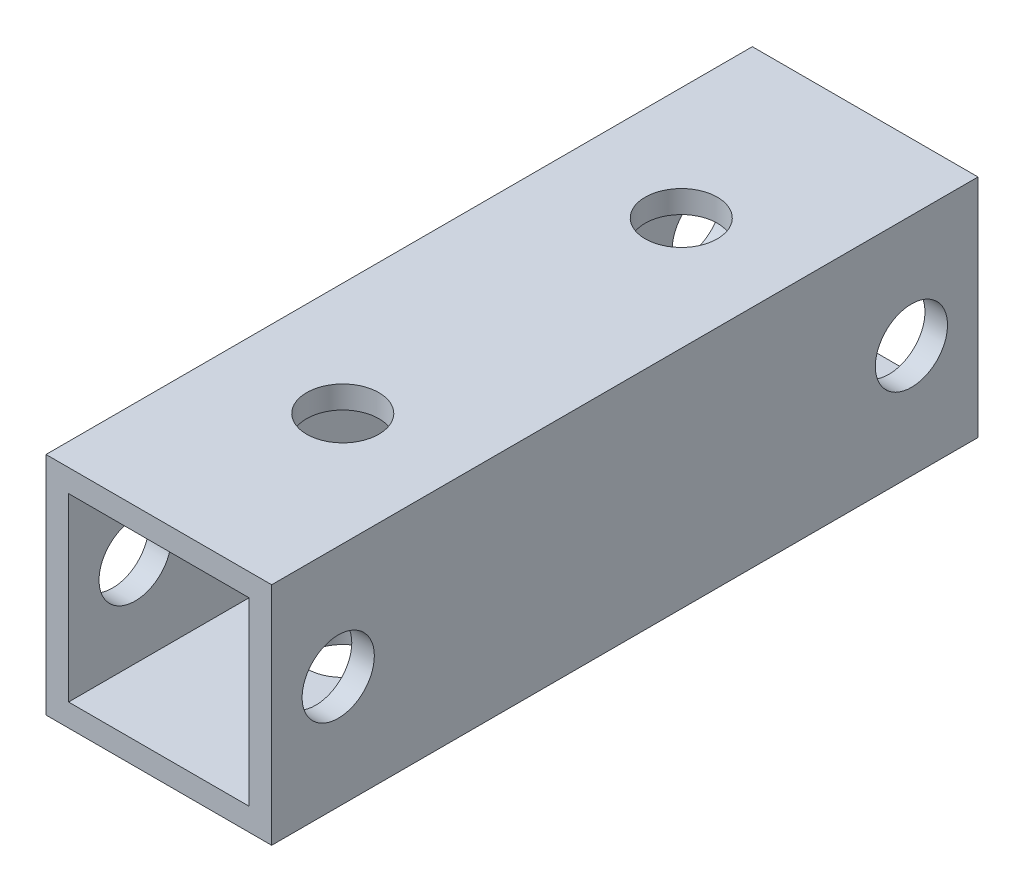
from build123d import *

# Parameters (mm, degrees)
SKETCH_2_W          = 10
SKETCH_2_H          = 10
SKETCH_2_W_2        = 8
SKETCH_2_H_2        = 8
EXTRUDE_1_DEPTH     = 31.3
CUT_EXTRUDE_1_REACH = 36.347
SKETCH_3_R          = 1.6
CUT_EXTRUDE_2_REACH = 36.347
SKETCH_4_R          = 1.6


with BuildPart() as part:
    # ｽｹｯﾁ2 → 押し出し-薄板1 (new body)
    with BuildSketch(Plane.XY):
        with Locations((5, 5)):
            Rectangle(SKETCH_2_W, SKETCH_2_H)
        with Locations((5, 5)):
            Rectangle(SKETCH_2_W_2, SKETCH_2_H_2, mode=Mode.SUBTRACT)
    extrude(amount=EXTRUDE_1_DEPTH)

    # ｶｯﾄ - 押し出し1: up to this face of the body (flat: up to its plane)
    cut_extrude_1_end = Plane(part.part.faces().sort_by_distance((5, 0, 15.65))[0])
    # ｽｹｯﾁ3 → ｶｯﾄ - 押し出し1 (cut, up to the picked face)
    with BuildSketch(Plane(origin=(0, 10, 0), x_dir=(1, 0, 0), z_dir=(0, 1, 0)), mode=Mode.PRIVATE) as cut_extrude_1_sk1:
        with Locations(Location((5, -23.15, 0), (0, 0, 270))):
            Circle(SKETCH_3_R)
    cut_extrude_1_tool1 = split(extrude(cut_extrude_1_sk1.sketch, amount=-CUT_EXTRUDE_1_REACH, mode=Mode.PRIVATE), bisect_by=cut_extrude_1_end, keep=Keep.BOTH, mode=Mode.PRIVATE)
    # ｽｹｯﾁ3 → ｶｯﾄ - 押し出し1 (cut, up to the picked face)
    with BuildSketch(Plane(origin=(0, 10, 0), x_dir=(1, 0, 0), z_dir=(0, 1, 0)), mode=Mode.PRIVATE) as cut_extrude_1_sk2:
        with Locations(Location((5, -8.15, 0), (0, 0, 270))):
            Circle(SKETCH_3_R)
    cut_extrude_1_tool2 = split(extrude(cut_extrude_1_sk2.sketch, amount=-CUT_EXTRUDE_1_REACH, mode=Mode.PRIVATE), bisect_by=cut_extrude_1_end, keep=Keep.BOTH, mode=Mode.PRIVATE)
    add(cut_extrude_1_tool1.solids().sort_by(Axis((5, 10, 23.15), (0, -1, 0)))[0], mode=Mode.SUBTRACT)
    add(cut_extrude_1_tool2.solids().sort_by(Axis((5, 10, 8.15), (0, -1, 0)))[0], mode=Mode.SUBTRACT)

    # ｶｯﾄ - 押し出し2: up to this face of the body (flat: up to its plane)
    cut_extrude_2_end = Plane(part.part.faces().sort_by_distance((0, 5, 15.65))[0])
    # ｽｹｯﾁ4 → ｶｯﾄ - 押し出し2 (cut, up to the picked face)
    with BuildSketch(Plane(origin=(10, 0, 0), x_dir=(0, 0, -1), z_dir=(1, 0, 0)), mode=Mode.PRIVATE) as cut_extrude_2_sk1:
        with Locations((-28.35, 5)):
            Circle(SKETCH_4_R)
    cut_extrude_2_tool1 = split(extrude(cut_extrude_2_sk1.sketch, amount=-CUT_EXTRUDE_2_REACH, mode=Mode.PRIVATE), bisect_by=cut_extrude_2_end, keep=Keep.BOTH, mode=Mode.PRIVATE)
    # ｽｹｯﾁ4 → ｶｯﾄ - 押し出し2 (cut, up to the picked face)
    with BuildSketch(Plane(origin=(10, 0, 0), x_dir=(0, 0, -1), z_dir=(1, 0, 0)), mode=Mode.PRIVATE) as cut_extrude_2_sk2:
        with Locations(Location((-2.95, 5, 0), (0, 0, 180))):
            Circle(SKETCH_4_R)
    cut_extrude_2_tool2 = split(extrude(cut_extrude_2_sk2.sketch, amount=-CUT_EXTRUDE_2_REACH, mode=Mode.PRIVATE), bisect_by=cut_extrude_2_end, keep=Keep.BOTH, mode=Mode.PRIVATE)
    add(cut_extrude_2_tool1.solids().sort_by(Axis((10, 5, 28.35), (-1, 0, 0)))[0], mode=Mode.SUBTRACT)
    add(cut_extrude_2_tool2.solids().sort_by(Axis((10, 5, 2.95), (-1, 0, 0)))[0], mode=Mode.SUBTRACT)


solid = part.part
